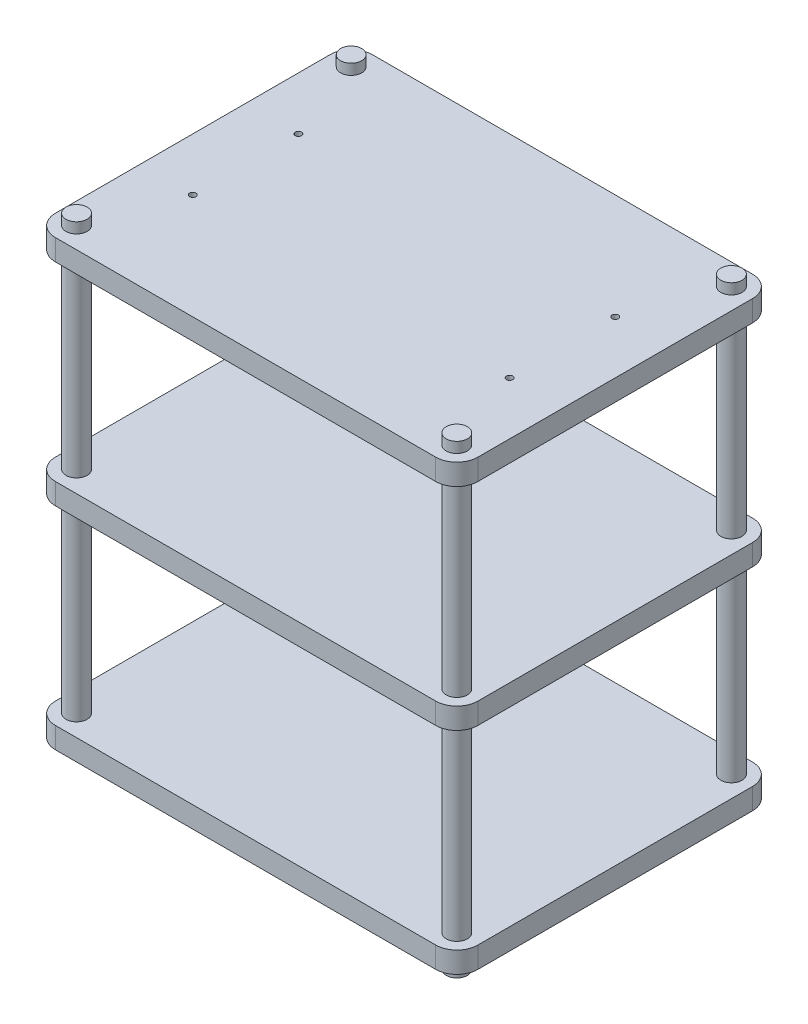
from build123d import *

# Parameters (mm, degrees)
SKETCH1_W            = 200
SKETCH1_H            = 150
BOSS_EXTRUDE1_DEPTH  = 10
SKETCH2_R            = 5
CUT_EXTRUDE1_DEPTH   = 10
SKETCH3_W            = 200
SKETCH3_H            = 150
SKETCH3_R            = 5
BOSS_EXTRUDE2_DEPTH  = 10
SKETCH4_W            = 200
SKETCH4_H            = 150
SKETCH4_R            = 5
BOSS_EXTRUDE3_DEPTH  = 10
BOSS_EXTRUDE13_START = 205
SKETCH21_R           = 5
BOSS_EXTRUDE13_DEPTH = 205
SKETCH22_R           = 5
BOSS_EXTRUDE14_DEPTH = 15
FILLET2_R            = 10
SKETCH23_R           = 1.5
CUT_EXTRUDE2_DEPTH   = 10
SKETCH30_W           = 66
SKETCH30_H           = 47
BOSS_EXTRUDE16_DEPTH = 1


with BuildPart() as part:
    # Sketch1 → Boss-Extrude1 (new body)
    with BuildSketch(Plane(origin=(0, 0, 0), x_dir=(1, 0, 0), z_dir=(0, 1, 0))):
        Rectangle(SKETCH1_W, SKETCH1_H)
    extrude(amount=BOSS_EXTRUDE1_DEPTH)

    # Sketch2 → Cut-Extrude1 (cut)
    with BuildSketch(Plane(origin=(0, 10, 0), x_dir=(1, 0, 0), z_dir=(0, 1, 0))):
        with Locations(Location((-90, 65, 0), (0, 0, 270))):
            Circle(SKETCH2_R)
        with Locations(Location((90, 65, 0), (0, 0, 90))):
            Circle(SKETCH2_R)
        with Locations(Location((90, -65, 0), (0, 0, 270))):
            Circle(SKETCH2_R)
        with Locations(Location((-90, -65, 0), (0, 0, 90))):
            Circle(SKETCH2_R)
    extrude(amount=-CUT_EXTRUDE1_DEPTH, mode=Mode.SUBTRACT)



with BuildPart() as body_2:
    # Sketch3 → Boss-Extrude2 (new body)
    with BuildSketch(Plane(origin=(0, 100, 0), x_dir=(1, 0, 0), z_dir=(0, 1, 0))):
        Rectangle(SKETCH3_W, SKETCH3_H)
        with Locations(Location((-90, 65, 0), (0, 0, 270))):
            Circle(SKETCH3_R, mode=Mode.SUBTRACT)
        with Locations(Location((90, 65, 0), (0, 0, 90))):
            Circle(SKETCH3_R, mode=Mode.SUBTRACT)
        with Locations(Location((-90, -65, 0), (0, 0, 90))):
            Circle(SKETCH3_R, mode=Mode.SUBTRACT)
        with Locations(Location((90, -65, 0), (0, 0, 270))):
            Circle(SKETCH3_R, mode=Mode.SUBTRACT)
    extrude(amount=BOSS_EXTRUDE2_DEPTH)



with BuildPart() as body_3:
    # Sketch4 → Boss-Extrude3 (new body)
    with BuildSketch(Plane(origin=(0, 200, 0), x_dir=(1, 0, 0), z_dir=(0, 1, 0))):
        Rectangle(SKETCH4_W, SKETCH4_H)
        with Locations(Location((-90, 65, 0), (0, 0, 270))):
            Circle(SKETCH4_R, mode=Mode.SUBTRACT)
        with Locations(Location((90, 65, 0), (0, 0, 90))):
            Circle(SKETCH4_R, mode=Mode.SUBTRACT)
        with Locations(Location((90, -65, 0), (0, 0, 270))):
            Circle(SKETCH4_R, mode=Mode.SUBTRACT)
        with Locations(Location((-90, -65, 0), (0, 0, 90))):
            Circle(SKETCH4_R, mode=Mode.SUBTRACT)
    extrude(amount=BOSS_EXTRUDE3_DEPTH)


with BuildPart() as body_2_1:
    add(body_2.part)

    add(body_3.part)  # Boss-Extrude13 merges body 3
    # Sketch21 → Boss-Extrude13 (add)
    with BuildSketch(Plane(origin=(0, 10, 0), x_dir=(1, 0, 0), z_dir=(0, 1, 0)).offset(BOSS_EXTRUDE13_START)):
        with Locations(Location((-90, -65, 0), (0, 0, 90))):
            Circle(SKETCH21_R)
        with Locations(Location((-90, 65, 0), (0, 0, 270))):
            Circle(SKETCH21_R)
        with Locations(Location((90, 65, 0), (0, 0, 90))):
            Circle(SKETCH21_R)
        with Locations(Location((90, -65, 0), (0, 0, 270))):
            Circle(SKETCH21_R)
    extrude(amount=-BOSS_EXTRUDE13_DEPTH)


with BuildPart() as part_1:
    add(part.part)

    add(body_2_1.part)  # Boss-Extrude14 merges body 2
    # Sketch22 → Boss-Extrude14 (add)
    with BuildSketch(Plane(origin=(0, 10, 0), x_dir=(1, 0, 0), z_dir=(0, 1, 0))):
        with Locations(Location((-90, 65, 0), (0, 0, 270))):
            Circle(SKETCH22_R)
        with Locations(Location((-90, -65, 0), (0, 0, 270))):
            Circle(SKETCH22_R)
        with Locations(Location((90, -65, 0), (0, 0, 270))):
            Circle(SKETCH22_R)
        with Locations(Location((90, 65, 0), (0, 0, 270))):
            Circle(SKETCH22_R)
    extrude(amount=-BOSS_EXTRUDE14_DEPTH)

    # Fillet2
    fillet2_edges = [part_1.edges().sort_by_distance(p)[0] for p in [
        (100, 105, 75),
        (100, 105, -75),
        (-100, 105, -75),
        (-100, 105, 75),
        (100, 205, 75),
        (100, 205, -75),
        (-100, 205, -75),
        (-100, 205, 75),
        (100, 5, 75),
        (-100, 5, 75),
        (-100, 5, -75),
        (100, 5, -75),
    ]]
    fillet(fillet2_edges, radius=FILLET2_R)

    # Sketch23 → Cut-Extrude2 (cut)
    with BuildSketch(Plane(origin=(0, 210, 0), x_dir=(1, 0, 0), z_dir=(0, 1, 0))):
        with Locations(Location((-75, 25, 0), (0, 0, 270))):
            Circle(SKETCH23_R)
        with Locations(Location((-75, -25, 0), (0, 0, 90))):
            Circle(SKETCH23_R)
        with Locations(Location((75, -25, 0), (0, 0, 270))):
            Circle(SKETCH23_R)
        with Locations(Location((75, 25, 0), (0, 0, 90))):
            Circle(SKETCH23_R)
    extrude(amount=-CUT_EXTRUDE2_DEPTH, mode=Mode.SUBTRACT)

    # Sketch30 → Boss-Extrude16 (add)
    with BuildSketch(Plane(origin=(0, 200, 0), x_dir=(-1, 0, 0), z_dir=(0, -1, 0))):
        Rectangle(SKETCH30_W, SKETCH30_H)
    extrude(amount=BOSS_EXTRUDE16_DEPTH)


solid = part_1.part
